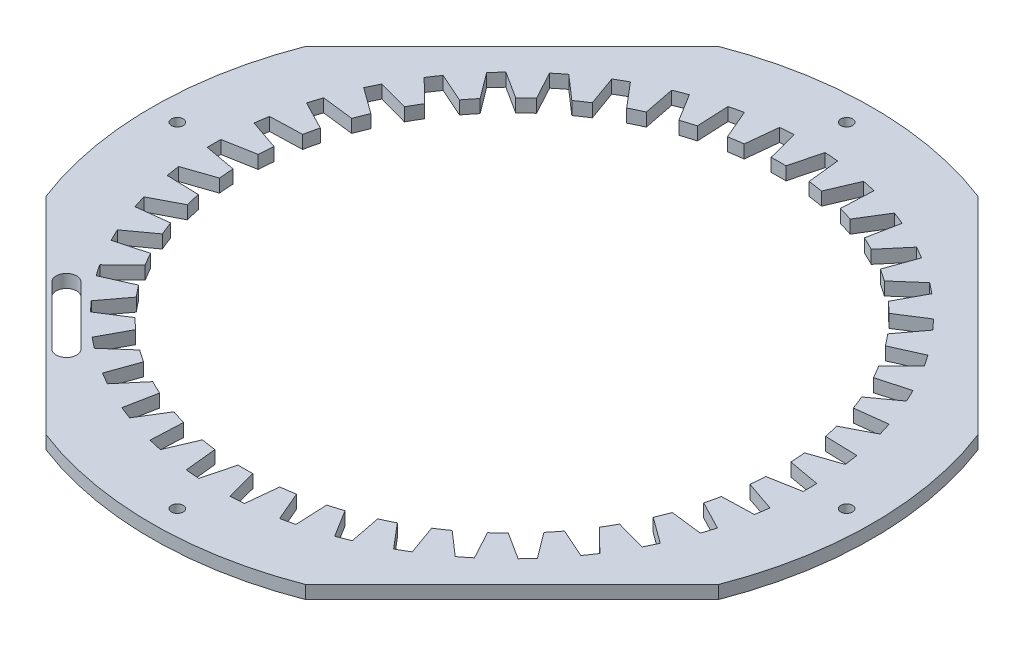
from build123d import *

# Parameters (mm, degrees)
SKETCH1_R           = 87.5
SKETCH1_R_2         = 64.73319196
SKETCH1_R_3         = 1.425
BOSS_EXTRUDE1_DEPTH = 3.175
CUT_EXTRUDE1_DEPTH  = 124.784411882
CIRPATTERN1_COUNT   = 42
CUT_EXTRUDE2_DEPTH  = 124.784411882
CUT_EXTRUDE3_DEPTH  = 124.784411882


with BuildPart() as part:
    # Sketch1 → Boss-Extrude1 (new body)
    with BuildSketch(Plane(origin=(0, 0, 0), x_dir=(1, 0, 0), z_dir=(0, 1, 0))):
        with Locations(Location((0, 0, 0), (0, 0, 270))):
            Circle(SKETCH1_R)
        with Locations(Location((0, 0, 0), (0, 0, 270))):
            Circle(SKETCH1_R_2, mode=Mode.SUBTRACT)
        with Locations(Location((-81.25, 0, 0), (0, 0, 270))):
            Circle(SKETCH1_R_3, mode=Mode.SUBTRACT)
        with Locations(Location((0, 81.25, 0), (0, 0, 270))):
            Circle(SKETCH1_R_3, mode=Mode.SUBTRACT)
        with Locations(Location((81.25, 0, 0), (0, 0, 270))):
            Circle(SKETCH1_R_3, mode=Mode.SUBTRACT)
        with Locations(Location((0, -81.25, 0), (0, 0, 270))):
            Circle(SKETCH1_R_3, mode=Mode.SUBTRACT)
    extrude(amount=BOSS_EXTRUDE1_DEPTH)

    # Sketch2 → Cut-Extrude1 (cut, through all)
    with BuildSketch(Plane(origin=(0, 3.175, 0), x_dir=(1, 0, 0), z_dir=(0, 1, 0))):
        with BuildLine():
            Line((64.66123202, 3.05142835), (72.339184363, 1.658417765))
            ThreePointArc((72.339184363, 1.658417765), (72.35819196, 0), (72.339184363, -1.658417765))
            Line((72.339184363, -1.658417765), (64.66123202, -3.05142835))
            ThreePointArc((64.66123202, -3.05142835), (64.73319196, 0), (64.66123202, 3.05142835))
        make_face()
    cut_extrude1 = extrude(amount=-CUT_EXTRUDE1_DEPTH, mode=Mode.SUBTRACT)

    # CirPattern1: Cut-Extrude1 ×42 about axis
    cirpattern1_axis = Axis((0, 0, 0), (0, 1, 0))
    for i in range(1, CIRPATTERN1_COUNT):
        add(cut_extrude1.rotate(cirpattern1_axis, i * 360 / CIRPATTERN1_COUNT), mode=Mode.SUBTRACT)

    # Sketch3 → Cut-Extrude2 (cut, through all)
    with BuildSketch(Plane(origin=(0, 3.175, 0), x_dir=(1, 0, 0), z_dir=(0, 1, 0))):
        with BuildLine():
            Line((-113.13708499, 0), (0, 113.13708499))
            ThreePointArc((0, 113.13708499), (-80, 80), (-113.13708499, 0))
        make_face()
        with BuildLine():
            Line((0, 113.13708499), (113.13708499, 0))
            ThreePointArc((113.13708499, 0), (80, 80), (0, 113.13708499))
        make_face()
        with BuildLine():
            ThreePointArc((0, -113.13708499), (80, -80), (113.13708499, 0))
            Line((113.13708499, 0), (0, -113.13708499))
        make_face()
        with BuildLine():
            ThreePointArc((-113.13708499, 0), (-80, -80), (0, -113.13708499))
            Line((0, -113.13708499), (-113.13708499, 0))
        make_face()
    extrude(amount=-CUT_EXTRUDE2_DEPTH, mode=Mode.SUBTRACT)

    # Sketch4 → Cut-Extrude3 (cut, through all)
    with BuildSketch(Plane(origin=(0, 3.175, 0), x_dir=(1, 0, 0), z_dir=(0, 1, 0))):
        with BuildLine():
            Line((-59.39696962, -45.254833996), (-45.254833996, -59.39696962))
            ThreePointArc((-45.254833996, -59.39696962), (-45.254833996, -62.932503526), (-48.790367902, -62.932503526))
            Line((-48.790367902, -62.932503526), (-62.932503526, -48.790367902))
            ThreePointArc((-62.932503526, -48.790367902), (-62.932503526, -45.254833996), (-59.39696962, -45.254833996))
        make_face()
    extrude(amount=-CUT_EXTRUDE3_DEPTH, mode=Mode.SUBTRACT)


solid = part.part
